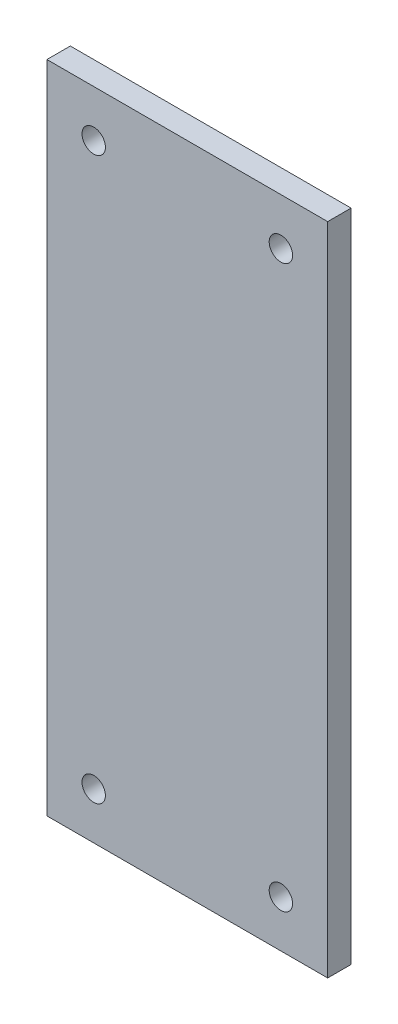
from build123d import *

# Parameters (mm, degrees)
SKETCH1_W           = 76.2
SKETCH1_H           = 177.8
SKETCH1_R           = 3.175
BOSS_EXTRUDE1_DEPTH = 6.35


with BuildPart() as part:
    # Sketch1 → Boss-Extrude1 (new body)
    with BuildSketch(Plane.XY):
        with Locations((-111.06308909, -44.45)):
            Rectangle(SKETCH1_W, SKETCH1_H)
        with Locations((-85.66308909, -120.65)):
            Circle(SKETCH1_R, mode=Mode.SUBTRACT)
        with Locations((-136.46308909, -120.65)):
            Circle(SKETCH1_R, mode=Mode.SUBTRACT)
        with Locations((-85.66308909, 31.75)):
            Circle(SKETCH1_R, mode=Mode.SUBTRACT)
        with Locations((-136.46308909, 31.75)):
            Circle(SKETCH1_R, mode=Mode.SUBTRACT)
    extrude(amount=BOSS_EXTRUDE1_DEPTH)


solid = part.part
